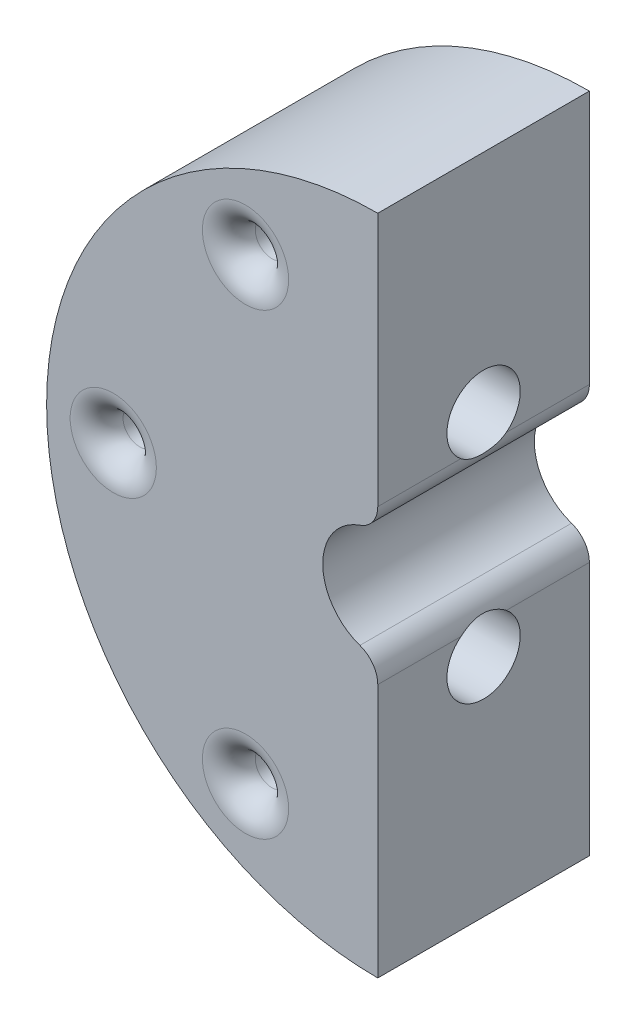
from build123d import *

# Parameters (mm, degrees)
SKETCH1_R            = 9.9375
SKETCH1_R_2          = 1.651
SKETCH1_R_3          = 0.5
BOSS_EXTRUDE1_DEPTH  = 6.35
CUT_EXTRUDE1_DEPTH   = 16.421748036
FILLET1_R            = 0.79375
FILLET2_R            = 0.79375
M2_CLEARANCE_HOLE1_D = 2.2
CUT_EXTRUDE2_DEPTH   = 4.7625


with BuildPart() as part:
    # Sketch1 → Boss-Extrude1 (new body)
    with BuildSketch(Plane.XY):
        Circle(SKETCH1_R)
        Circle(SKETCH1_R_2, mode=Mode.SUBTRACT)
        with Locations((-7.9375, 0)):
            Circle(SKETCH1_R_3, mode=Mode.SUBTRACT)
        with Locations((-3.96875, 6.874076643)):
            Circle(SKETCH1_R_3, mode=Mode.SUBTRACT)
        with Locations((3.96875, 6.874076643)):
            Circle(SKETCH1_R_3, mode=Mode.SUBTRACT)
        with Locations((7.9375, 0)):
            Circle(SKETCH1_R_3, mode=Mode.SUBTRACT)
        with Locations((3.96875, -6.874076643)):
            Circle(SKETCH1_R_3, mode=Mode.SUBTRACT)
        with Locations((-3.96875, -6.874076643)):
            Circle(SKETCH1_R_3, mode=Mode.SUBTRACT)
    extrude(amount=BOSS_EXTRUDE1_DEPTH)

    # Sketch2 → Cut-Extrude1 (cut, through all)
    with BuildSketch(Plane.XY.offset(6.35)):
        Polygon((0, 0), (0, 25.4), (50.8, 25.4), (50.8, -25.4), (0, -25.4), align=None)
    extrude(amount=-CUT_EXTRUDE1_DEPTH, mode=Mode.SUBTRACT)

    # Fillet1
    fillet1_edges = [part.edges().sort_by_distance(p)[0] for p in [
        (0, -1.651, 3.175),
        (0, 1.651, 3.175),
    ]]
    fillet(fillet1_edges, radius=FILLET1_R)

    # Fillet2
    fillet2_edges = [part.edges().sort_by_distance(p)[0] for p in [
        (-4.46875, 6.874076643, 0),
        (-4.46875, 6.874076643, 6.35),
        (-4.46875, -6.874076643, 0),
        (-4.46875, -6.874076643, 6.35),
        (-8.4375, 0, 0),
        (-8.4375, 0, 6.35),
    ]]
    fillet(fillet2_edges, radius=FILLET2_R)

    # M2 Clearance Hole1 (through all)
    with Locations(Plane.ZY.offset(9.9375)):
        with Locations((3.175, 3.175), (3.175, -3.175)):
            Hole(M2_CLEARANCE_HOLE1_D / 2)

    # Sketch13 → Cut-Extrude2 (cut)
    with BuildSketch(Plane.ZY.offset(9.9375)):
        Polygon((1.175, 4.329700538), (1.175, 2.020299462), (3.175, 0.865598923), (5.175, 2.020299462), (5.175, 4.329700538), (3.175, 5.484401077), align=None)
        Polygon((1.175, -2.020299462), (1.175, -4.329700538), (3.175, -5.484401077), (5.175, -4.329700538), (5.175, -2.020299462), (3.175, -0.865598923), align=None)
    extrude(amount=-CUT_EXTRUDE2_DEPTH, mode=Mode.SUBTRACT)


solid = part.part
